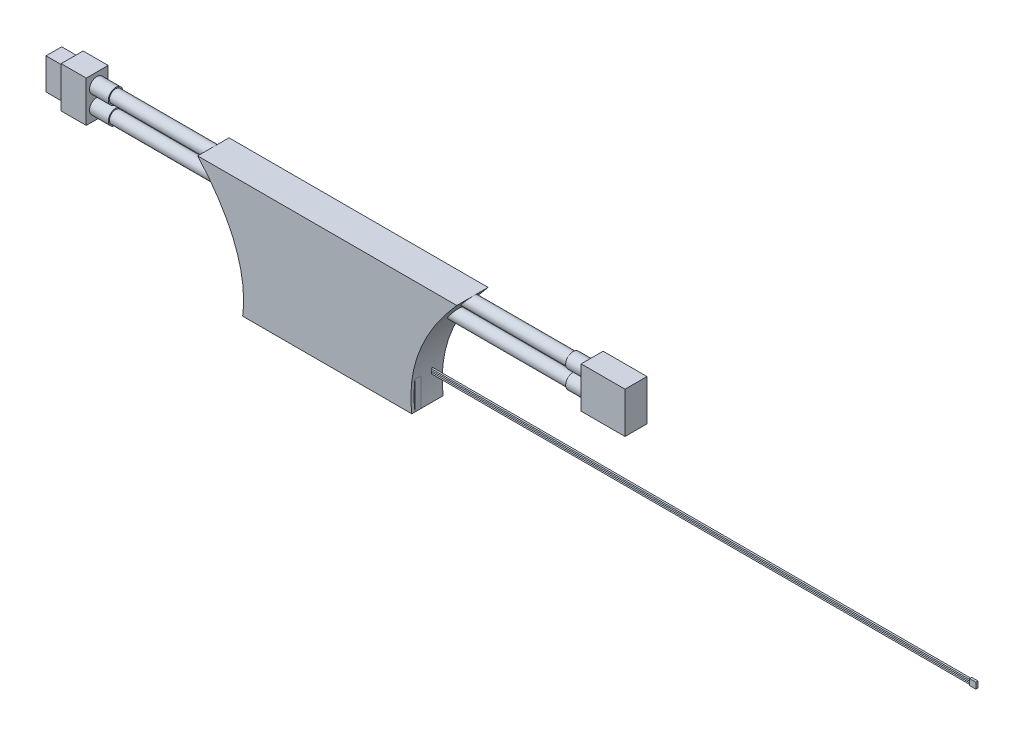
from build123d import *

# Parameters (mm, degrees)
SKETCH1_W                   = 27
SKETCH1_H                   = 18
BOSS_EXTRUDE8_DEPTH         = 1
SKETCH8_W                   = 12
SKETCH8_H                   = 12
BOSS_EXTRUDE10_DEPTH        = 3.5
BOSS_EXTRUDE11_DEPTH        = 23
BOSS_EXTRUDE11_DEPTH_BACK   = 50
SKETCH9_R                   = 1
BOSS_EXTRUDE11_2_DEPTH      = 23
BOSS_EXTRUDE11_2_DEPTH_BACK = 50
SKETCH10_R                  = 1.179103969
SKETCH10_R_2                = 1.18
BOSS_EXTRUDE12_DEPTH        = 3
SKETCH11_R                  = 1.18
BOSS_EXTRUDE13_DEPTH        = 3
SKETCH12_W                  = 3.503549992
SKETCH12_H                  = 6.548691573
BOSS_EXTRUDE14_DEPTH        = 7
SKETCH13_W                  = 3.5
SKETCH13_H                  = 6.55
BOSS_EXTRUDE15_DEPTH        = 4
SKETCH14_W                  = 2.5
SKETCH14_H                  = 5
BOSS_EXTRUDE16_DEPTH        = 3
SKETCH15_R                  = 0.1
BOSS_EXTRUDE20_DEPTH        = 100
SKETCH16_W                  = 0.338953989
SKETCH16_H                  = 0.974492718
BOSS_EXTRUDE21_DEPTH        = 1
SKETCH17_W                  = 12
SKETCH17_H                  = 12
BOSS_EXTRUDE22_DEPTH        = 5


with BuildPart() as part:
    # Sketch1 → Boss-Extrude8 (new body)
    with BuildSketch(Plane.XY):
        with Locations((13.5, 9)):
            Rectangle(SKETCH1_W, SKETCH1_H)
    extrude(amount=-BOSS_EXTRUDE8_DEPTH)

    # Sketch8 → Boss-Extrude10 (add)
    with BuildSketch(Plane(origin=(0, 0, -1), x_dir=(-1, 0, 0), z_dir=(0, 0, -1))):
        with Locations((-6.950011558, 6)):
            Rectangle(SKETCH8_W, SKETCH8_H)
    extrude(amount=BOSS_EXTRUDE10_DEPTH)

    # Sketch15 → Boss-Extrude20 (add)
    with BuildSketch(Plane(origin=(12.950011558, 0, 0), x_dir=(0, 0, -1), z_dir=(1, 0, 0))):
        with Locations((2.75, 4.69)):
            Circle(SKETCH15_R)
        with Locations((2.75, 4.46)):
            Circle(SKETCH15_R)
        with Locations((2.75, 4.23)):
            Circle(SKETCH15_R)
        with Locations((2.75, 4)):
            Circle(SKETCH15_R)
    extrude(amount=BOSS_EXTRUDE20_DEPTH)

    # Sketch16 → Boss-Extrude21 (add)
    with BuildSketch(Plane(origin=(112.950011558, 0, 0), x_dir=(0, 0, -1), z_dir=(1, 0, 0))):
        with Locations((2.751438269, 4.356787815)):
            Rectangle(SKETCH16_W, SKETCH16_H)
    extrude(amount=BOSS_EXTRUDE21_DEPTH)


with BuildPart() as body_2:
    # Sketch9 → Boss-Extrude11 (new, two sides: drawn at the far end of the back side and taken through both)
    with BuildSketch(Plane(origin=(27, 0, 0), x_dir=(0, 0, -1), z_dir=(1, 0, 0)).offset(-BOSS_EXTRUDE11_DEPTH_BACK)):
        with Locations((2.236693828, 17.569174757)):
            Circle(SKETCH9_R)
    extrude(amount=BOSS_EXTRUDE11_DEPTH + BOSS_EXTRUDE11_DEPTH_BACK)



with BuildPart() as body_3:
    # Sketch9 → Boss-Extrude11 2 (new, two sides: drawn at the far end of the back side and taken through both)
    with BuildSketch(Plane(origin=(27, 0, 0), x_dir=(0, 0, -1), z_dir=(1, 0, 0)).offset(-BOSS_EXTRUDE11_2_DEPTH_BACK)):
        with Locations((2.236693828, 14.695041609)):
            Circle(SKETCH9_R)
    extrude(amount=BOSS_EXTRUDE11_2_DEPTH + BOSS_EXTRUDE11_2_DEPTH_BACK)


with BuildPart() as body_2_1:
    add(body_2.part)

    add(body_3.part)  # Boss-Extrude12 merges body 3
    # Sketch10 → Boss-Extrude12 (add)
    with BuildSketch(Plane(origin=(50, 0, 0), x_dir=(0, 0, -1), z_dir=(1, 0, 0))):
        with Locations((2.236693828, 17.569174757)):
            Circle(SKETCH10_R)
        with Locations((2.236693828, 14.695041609)):
            Circle(SKETCH10_R_2)
    extrude(amount=BOSS_EXTRUDE12_DEPTH)

    # Sketch11 → Boss-Extrude13 (add)
    with BuildSketch(Plane.ZY.offset(23)):
        with Locations((-2.236693828, 17.569174757)):
            Circle(SKETCH11_R)
        with Locations(Location((-2.236693828, 14.695041609, 0), (0, 0, 180))):
            Circle(SKETCH11_R)
    extrude(amount=BOSS_EXTRUDE13_DEPTH)

    # Sketch12 → Boss-Extrude14 (add)
    with BuildSketch(Plane(origin=(53, 0, 0), x_dir=(0, 0, -1), z_dir=(1, 0, 0))):
        with Locations((2.282743458, 16.119739699)):
            Rectangle(SKETCH12_W, SKETCH12_H)
    extrude(amount=BOSS_EXTRUDE14_DEPTH)

    # Sketch13 → Boss-Extrude15 (add)
    with BuildSketch(Plane.ZY.offset(26)):
        with Locations((-2.284518454, 16.119085485)):
            Rectangle(SKETCH13_W, SKETCH13_H)
    extrude(amount=BOSS_EXTRUDE15_DEPTH)

    # Sketch14 → Boss-Extrude16 (add)
    with BuildSketch(Plane.ZY.offset(30)):
        with Locations((-2.361988806, 16.182652091)):
            Rectangle(SKETCH14_W, SKETCH14_H)
    extrude(amount=BOSS_EXTRUDE16_DEPTH)


with BuildPart() as body_3_2:
    # Sketch17 → Boss-Extrude22 (new body)
    with BuildSketch(Plane(origin=(0, 0, -4.5), x_dir=(-1, 0, 0), z_dir=(0, 0, -1))):
        with BuildLine():
            add(Edge.make_bspline(
                [(-34.179396659, 18.569174757), (-25.814861156, 9.21461033), (-27, 0)],
                knots=[0, 0, 0, 0.640923346, 0.640923346, 0.640923346], degree=2))
            Line((-27, 0), (-12.950011558, 0))
            Line((-12.950011558, 0), (-12.950011558, 12))
            Line((-12.950011558, 12), (-0.950011558, 12))
            Line((-0.950011558, 12), (-0.950011558, 0))
            Line((-0.950011558, 0), (0, 0))
            add(Edge.make_bspline(
                [(7.179396659, 18.569174757), (-1.185138844, 9.21461033), (0, 0)],
                knots=[0, 0, 0, 0.640923346, 0.640923346, 0.640923346], degree=2))
            Line((7.179396659, 18.569174757), (0, 18.569174757))
            Line((0, 18.569174757), (-27, 18.569174757))
            Line((-27, 18.569174757), (-34.179396659, 18.569174757))
        make_face()
        with Locations((-6.950011558, 6)):
            Rectangle(SKETCH17_W, SKETCH17_H)
    extrude(amount=-BOSS_EXTRUDE22_DEPTH)


solid = Compound([part.part, body_2_1.part, body_3_2.part])
